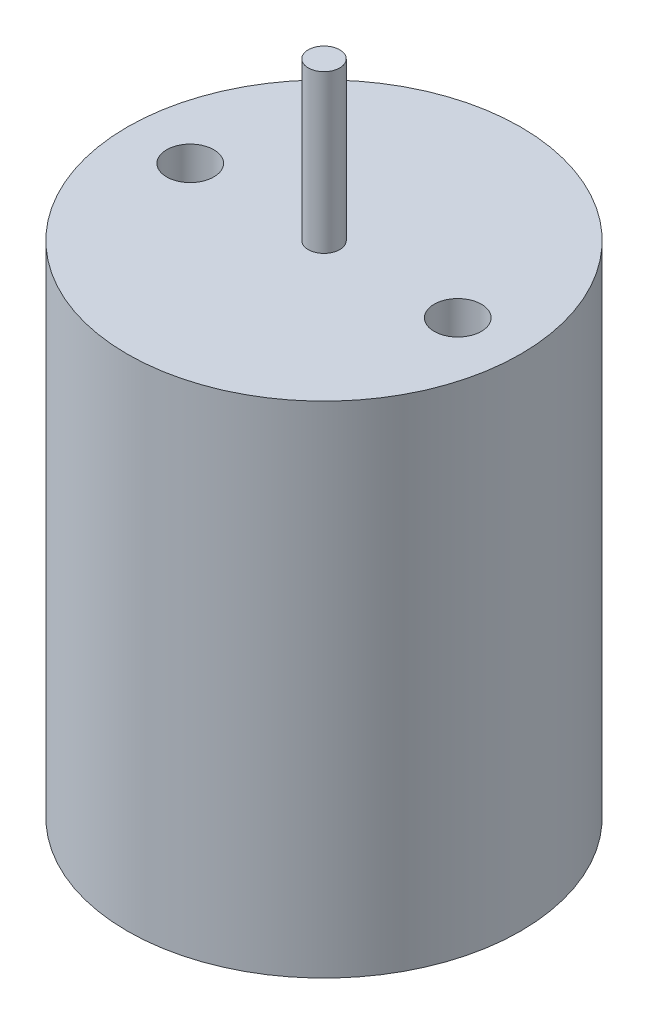
from build123d import *

# Parameters (mm, degrees)
SKETCH1_R           = 12.5
BOSS_EXTRUDE1_DEPTH = 31.75
SKETCH2_R           = 1
BOSS_EXTRUDE2_DEPTH = 10
SKETCH3_R           = 1.5
CUT_EXTRUDE1_DEPTH  = 6.35


with BuildPart() as part:
    # Sketch1 → Boss-Extrude1 (new body)
    with BuildSketch(Plane(origin=(0, 0, 0), x_dir=(1, 0, 0), z_dir=(0, 1, 0))):
        with Locations(Location((0, 0, 0), (0, 0, 270))):
            Circle(SKETCH1_R)
    extrude(amount=BOSS_EXTRUDE1_DEPTH)

    # Sketch2 → Boss-Extrude2 (add)
    with BuildSketch(Plane(origin=(0, 31.75, 0), x_dir=(1, 0, 0), z_dir=(0, 1, 0))):
        with Locations(Location((0, 0, 0), (0, 0, 270))):
            Circle(SKETCH2_R)
    extrude(amount=BOSS_EXTRUDE2_DEPTH)

    # Sketch3 → Cut-Extrude1 (cut)
    with BuildSketch(Plane(origin=(0, 31.75, 0), x_dir=(1, 0, 0), z_dir=(0, 1, 0))):
        with Locations(Location((-8.5, 0, 0), (0, 0, 270))):
            Circle(SKETCH3_R)
        with Locations(Location((8.5, 0, 0), (0, 0, 270))):
            Circle(SKETCH3_R)
    extrude(amount=-CUT_EXTRUDE1_DEPTH, mode=Mode.SUBTRACT)


solid = part.part
